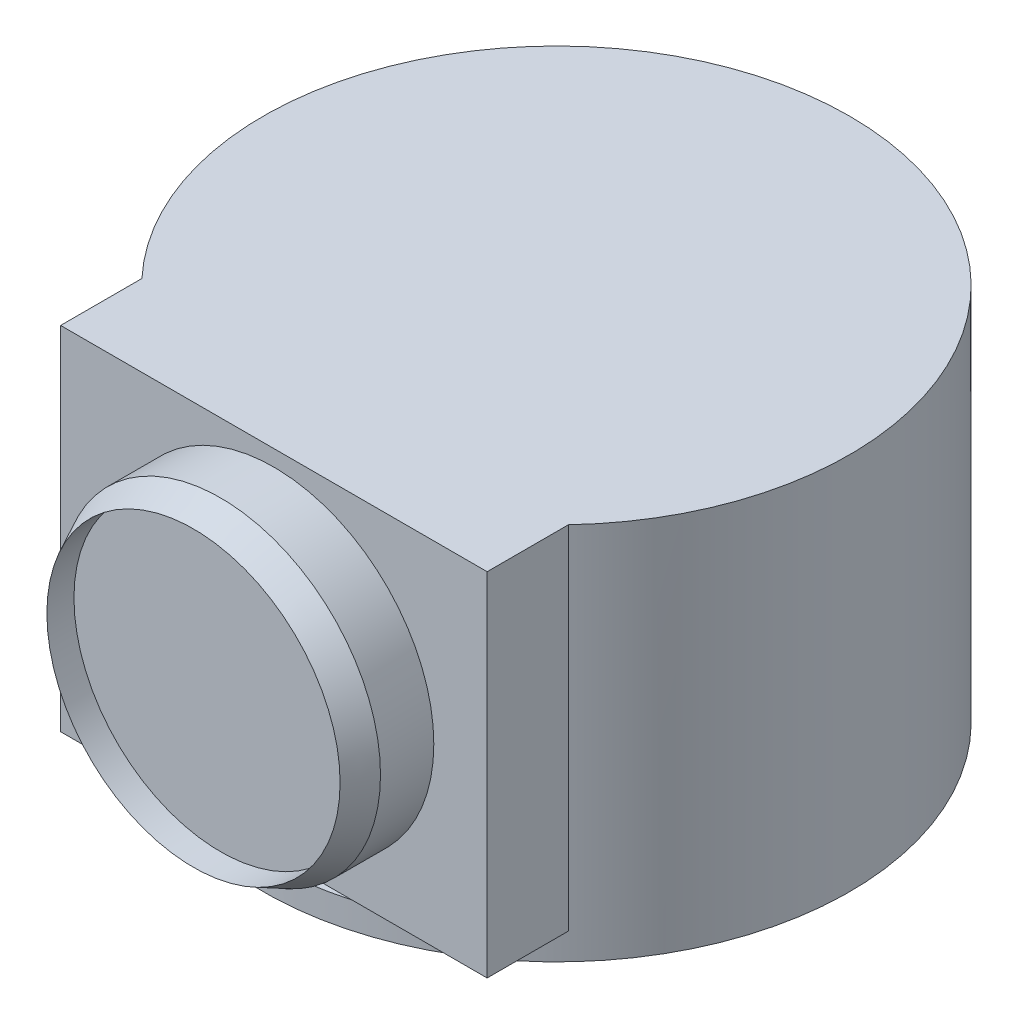
from build123d import *

# Parameters (mm, degrees)
SKETCH1_R           = 55
BOSS_EXTRUDE1_DEPTH = 66
BOSS_EXTRUDE3_DEPTH = 63
SKETCH5_R           = 56.242985336
SKETCH5_R_2         = 30
CUT_EXTRUDE2_DEPTH  = 10
BOSS_EXTRUDE4_START = 5
SKETCH6_R           = 55
BOSS_EXTRUDE4_DEPTH = 5


with BuildPart() as part:
    # Sketch1 → Boss-Extrude1 (new body)
    with BuildSketch(Plane(origin=(0, 0, 0), x_dir=(1, 0, 0), z_dir=(0, 1, 0))):
        with Locations(Location((0, 0, 0), (0, 0, 270))):
            Circle(SKETCH1_R)
    extrude(amount=BOSS_EXTRUDE1_DEPTH)

    # Sketch2 → Boss-Extrude3 (add)
    with BuildSketch(Plane.XY):
        Polygon((-40, 66), (-40, 0), (0, 0), (40, 0), (40, 66), align=None)
    extrude(amount=BOSS_EXTRUDE3_DEPTH)

    # Sketch4 → Revolve1 (revolve)
    with BuildSketch(Plane(origin=(0, 0, 0), x_dir=(0, 0, -1), z_dir=(1, 0, 0)), mode=Mode.PRIVATE) as revolve1_sk:
        Polygon((-63, 5.5), (-68.077040766, 5.5), (-63, 3), align=None)
    revolve(revolve1_sk.sketch.rotate(Axis((0, 33, 63), (0, 0, 1)), 270), axis=Axis((0, 33, 63), (0, 0, 1)))

    # Sketch5 → Cut-Extrude2 (cut)
    with BuildSketch(Plane.XY.offset(63)):
        with Locations((0, 33)):
            Circle(SKETCH5_R)
        with Locations((0, 33)):
            Circle(SKETCH5_R_2, mode=Mode.SUBTRACT)
    extrude(amount=-CUT_EXTRUDE2_DEPTH, mode=Mode.SUBTRACT)

    # Sketch6 → Boss-Extrude4 (add)
    with BuildSketch(Plane(origin=(0, 0, 0), x_dir=(-1, 0, 0), z_dir=(0, -1, 0)).offset(BOSS_EXTRUDE4_START)):
        with Locations(Location((0, 0, 0), (0, 0, 90))):
            Circle(SKETCH6_R)
    extrude(amount=-BOSS_EXTRUDE4_DEPTH)


solid = part.part
